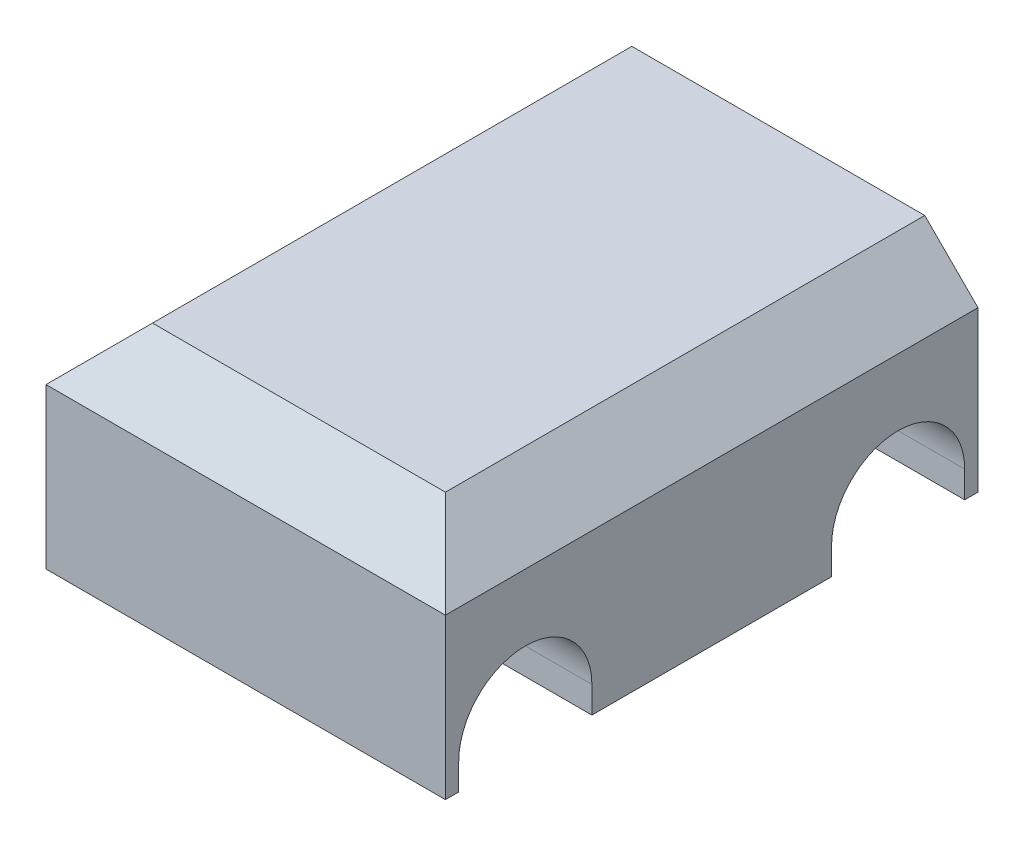
from build123d import *

# Parameters (mm, degrees)
SKETCH1_W            = 150
SKETCH1_H            = 200
BOSS_EXTRUDE1_DEPTH  = 80
CUT_EXTRUDE3_DEPTH   = 35
MIRROR2_COPY_1_DEPTH = 35
CHAMFER1_SIZE        = 20


with BuildPart() as part:
    # Sketch1 → Boss-Extrude1 (new body)
    with BuildSketch(Plane(origin=(0, 0, 0), x_dir=(1, 0, 0), z_dir=(0, 1, 0))):
        Rectangle(SKETCH1_W, SKETCH1_H)
    extrude(amount=BOSS_EXTRUDE1_DEPTH)

    # Sketch4 → Cut-Extrude3 (cut)
    with BuildSketch(Plane.ZY.offset(75)):
        with BuildLine():
            Line((-92.912878475, 0), (-95, 0))
            Line((-95, 0), (-95, -15))
            Line((-95, -15), (-70, -15))
            ThreePointArc((-70, -15), (-83.693063938, -10.916500663), (-92.912878475, 0))
        make_face()
        with BuildLine():
            ThreePointArc((-92.912878475, 0), (-94.472657823, 4.892258908), (-95, 10))
            Line((-95, 10), (-95, 0))
            Line((-95, 0), (-92.912878475, 0))
        make_face()
        with BuildLine():
            Line((-45, 10), (-95, 10))
            ThreePointArc((-95, 10), (-94.472657823, 4.892258908), (-92.912878475, 0))
            Line((-92.912878475, 0), (-47.087121525, 0))
            ThreePointArc((-47.087121525, 0), (-45.527342177, 4.892258908), (-45, 10))
        make_face()
        with BuildLine():
            ThreePointArc((-45, 10), (-70, 35), (-95, 10))
            Line((-95, 10), (-45, 10))
        make_face()
        with BuildLine():
            Line((-45, 0), (-45, 10))
            ThreePointArc((-45, 10), (-45.527342177, 4.892258908), (-47.087121525, 0))
            Line((-47.087121525, 0), (-45, 0))
        make_face()
        with BuildLine():
            Line((-45, -15), (-45, 0))
            Line((-45, 0), (-47.087121525, 0))
            ThreePointArc((-47.087121525, 0), (-56.306936062, -10.916500663), (-70, -15))
            Line((-70, -15), (-45, -15))
        make_face()
        with BuildLine():
            Line((-47.087121525, 0), (-92.912878475, 0))
            ThreePointArc((-92.912878475, 0), (-83.693063938, -10.916500663), (-70, -15))
            ThreePointArc((-70, -15), (-56.306936062, -10.916500663), (-47.087121525, 0))
        make_face()
    cut_extrude3 = extrude(amount=-CUT_EXTRUDE3_DEPTH, mode=Mode.SUBTRACT)

    # Mirror1: Cut-Extrude3 across plane
    add(cut_extrude3.mirror(Plane.XY), mode=Mode.SUBTRACT)

    # Mirror2: Cut-Extrude3 across plane
    add(cut_extrude3.mirror(Plane.ZY), mode=Mode.SUBTRACT)

    # Mirror2 copy 1 sketch → Mirror2 copy 1 (cut)
    with BuildSketch(Plane(origin=(75, 0, 0), x_dir=(0, 0, -1), z_dir=(1, 0, 0))):
        with BuildLine():
            Line((-92.912878475, 0), (-95, 0))
            Line((-95, 0), (-95, -15))
            Line((-95, -15), (-70, -15))
            ThreePointArc((-70, -15), (-83.693063938, -10.916500663), (-92.912878475, 0))
        make_face()
        with BuildLine():
            ThreePointArc((-92.912878475, 0), (-94.472657823, 4.892258908), (-95, 10))
            Line((-95, 10), (-95, 0))
            Line((-95, 0), (-92.912878475, 0))
        make_face()
        with BuildLine():
            Line((-45, 10), (-95, 10))
            ThreePointArc((-95, 10), (-94.472657823, 4.892258908), (-92.912878475, 0))
            Line((-92.912878475, 0), (-47.087121525, 0))
            ThreePointArc((-47.087121525, 0), (-45.527342177, 4.892258908), (-45, 10))
        make_face()
        with BuildLine():
            ThreePointArc((-45, 10), (-70, 35), (-95, 10))
            Line((-95, 10), (-45, 10))
        make_face()
        with BuildLine():
            Line((-45, 0), (-45, 10))
            ThreePointArc((-45, 10), (-45.527342177, 4.892258908), (-47.087121525, 0))
            Line((-47.087121525, 0), (-45, 0))
        make_face()
        with BuildLine():
            Line((-45, -15), (-45, 0))
            Line((-45, 0), (-47.087121525, 0))
            ThreePointArc((-47.087121525, 0), (-56.306936062, -10.916500663), (-70, -15))
            Line((-70, -15), (-45, -15))
        make_face()
        with BuildLine():
            Line((-47.087121525, 0), (-92.912878475, 0))
            ThreePointArc((-92.912878475, 0), (-83.693063938, -10.916500663), (-70, -15))
            ThreePointArc((-70, -15), (-56.306936062, -10.916500663), (-47.087121525, 0))
        make_face()
    extrude(amount=-MIRROR2_COPY_1_DEPTH, mode=Mode.SUBTRACT)

    # Chamfer1
    chamfer1_edges = [part.edges().sort_by_distance(p)[0] for p in [
        (-75, 80, 0),
        (0, 80, 100),
        (75, 80, 0),
    ]]
    chamfer(chamfer1_edges, length=CHAMFER1_SIZE)


solid = part.part
